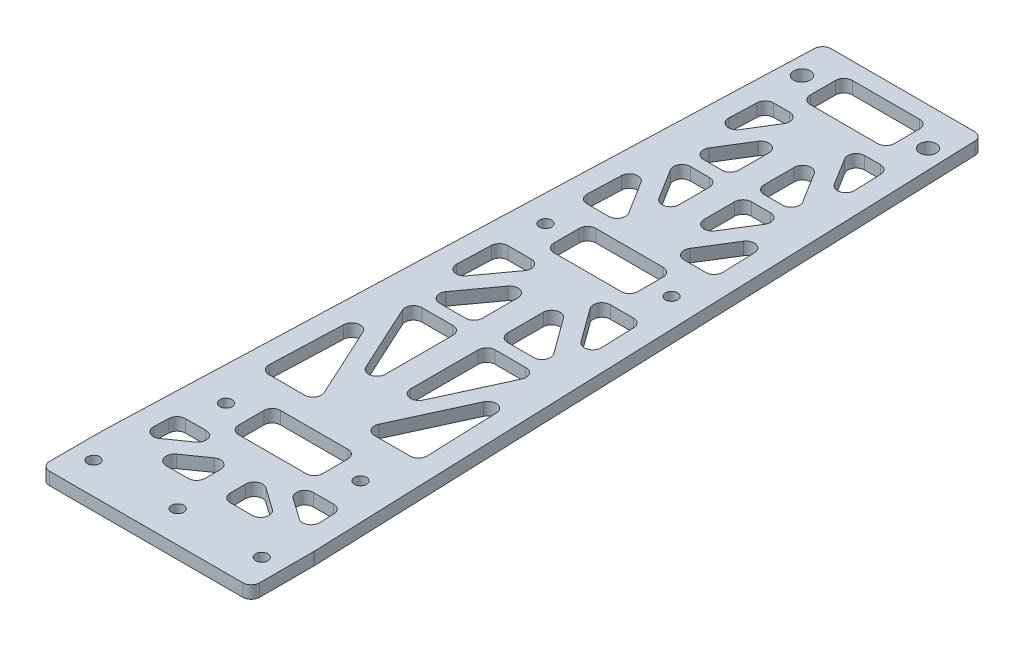
from build123d import *

# Parameters (mm, degrees)
SKETCH_1_R          = 1.45
SKETCH_1_R_2        = 1.95
EXTRUDE_1_DEPTH     = 3
EXTRUDE_2_DEPTH     = 3
FILLET_1_R          = 2
SKETCH_3_R          = 1.45
CUT_EXTRUDE_1_DEPTH = 167.910155473
SKETCH_4_R          = 1.45
CUT_EXTRUDE_2_DEPTH = 167.910155473
CUT_EXTRUDE_3_DEPTH = 167.910155473
SKETCH_6_W          = 6
SKETCH_6_H          = 147
EXTRUDE_3_DEPTH     = 3
EXTRUDE_6_DEPTH     = 3
FILLET_2_R          = 2
SKETCH_7_W          = 20
SKETCH_7_H          = 10
CUT_EXTRUDE_4_DEPTH = 167.910155473
FILLET_3_R          = 2


with BuildPart() as part:
    # 草图1 → 凸台-拉伸1 (new body)
    with BuildSketch(Plane(origin=(0, 0, 0), x_dir=(1, 0, 0), z_dir=(0, 1, 0))):
        Polygon((-25, 0), (-19, 0), (-19, 165), (19, 165), (19, 0), (25, 0), (25, -15), (-25, -15), align=None)
        with Locations(Location((0, -7.5, 0), (0, 0, 270))):
            Circle(SKETCH_1_R, mode=Mode.SUBTRACT)
        with Locations(Location((20, -7.5, 0), (0, 0, 270))):
            Circle(SKETCH_1_R, mode=Mode.SUBTRACT)
        with Locations(Location((-20, -7.5, 0), (0, 0, 270))):
            Circle(SKETCH_1_R, mode=Mode.SUBTRACT)
        with Locations(Location((-15, 156, 0), (0, 0, 270))):
            Circle(SKETCH_1_R_2, mode=Mode.SUBTRACT)
        with Locations(Location((15, 156, 0), (0, 0, 270))):
            Circle(SKETCH_1_R_2, mode=Mode.SUBTRACT)
    extrude(amount=EXTRUDE_1_DEPTH)

    # 草图2 → 凸台-拉伸2 (add)
    with BuildSketch(Plane(origin=(0, 3, 0), x_dir=(1, 0, 0), z_dir=(0, 1, 0))):
        Polygon((-19, 165), (-25, 0), (-19, 0), align=None)
        Polygon((19, 165), (25, 0), (19, 0), align=None)
    extrude(amount=-EXTRUDE_2_DEPTH)

    # 圆角1
    fillet_1_edges = [part.edges().sort_by_distance(p)[0] for p in [
        (-19, 1.5, -165),
        (19, 1.5, -165),
        (25, 1.5, 0),
        (25, 1.5, 15),
        (-25, 1.5, 15),
        (-25, 1.5, 0),
    ]]
    fillet(fillet_1_edges, radius=FILLET_1_R)

    # 草图3 → 切除-拉伸1 (cut, through all)
    with BuildSketch(Plane(origin=(0, 3, 0), x_dir=(1, 0, 0), z_dir=(0, 1, 0))):
        with Locations(Location((16, 20, 0), (0, 0, 270))):
            Circle(SKETCH_3_R)
        with Locations(Location((-16, 20, 0), (0, 0, 270))):
            Circle(SKETCH_3_R)
    extrude(amount=-CUT_EXTRUDE_1_DEPTH, mode=Mode.SUBTRACT)

    # 草图4 → 切除-拉伸2 (cut, through all)
    with BuildSketch(Plane(origin=(0, 3, 0), x_dir=(1, 0, 0), z_dir=(0, 1, 0))):
        with Locations(Location((-15, 95, 0), (0, 0, 270))):
            Circle(SKETCH_4_R)
        with Locations(Location((15, 95, 0), (0, 0, 270))):
            Circle(SKETCH_4_R)
    extrude(amount=-CUT_EXTRUDE_2_DEPTH, mode=Mode.SUBTRACT)

    # 草图5 → 切除-拉伸3 (cut, through all)
    with BuildSketch(Plane(origin=(0, 3, 0), x_dir=(1, 0, 0), z_dir=(0, 1, 0))):
        Polygon((-15.378513489, 127), (0, 127), (0, 147), (-14.651240762, 147), align=None)
        Polygon((0, 147), (0, 127), (15.378513489, 127), (14.651240762, 147), align=None)
        Polygon((-16.214877125, 104), (0, 104), (0, 124), (-15.487604398, 124), align=None)
        Polygon((0, 124), (0, 104), (16.214877125, 104), (15.487604398, 124), align=None)
        Polygon((-17.596695307, 66), (0, 66), (0, 86), (-16.86942258, 86), align=None)
        Polygon((0, 86), (0, 66), (17.596695307, 66), (16.86942258, 86), align=None)
        Polygon((-18.86942258, 31), (0, 31), (0, 63), (-17.705786216, 63), align=None)
        Polygon((0, 63), (0, 31), (18.86942258, 31), (17.705786216, 63), align=None)
        Polygon((-19.996695307, 0), (0, 0), (0, 12), (-19.560331671, 12), align=None)
        Polygon((0, 12), (0, 0), (19.996695307, 0), (19.560331671, 12), align=None)
    extrude(amount=-CUT_EXTRUDE_3_DEPTH, mode=Mode.SUBTRACT)

    # 草图6 → 凸台-拉伸3 (add)
    with BuildSketch(Plane(origin=(0, 3, 0), x_dir=(1, 0, 0), z_dir=(0, 1, 0))):
        with Locations((0, 73.5)):
            Rectangle(SKETCH_6_W, SKETCH_6_H)
    extrude(amount=-EXTRUDE_3_DEPTH)

    # 草图9 → 凸台-拉伸6 (add)
    with BuildSketch(Plane(origin=(0, 3, 0), x_dir=(1, 0, 0), z_dir=(0, 1, 0))):
        Polygon((-15.378513489, 127), (-3, 147), (-5.352079072, 147), (-15.231696253, 131.037473983), align=None)
        Polygon((-3, 143.199739049), (-3, 147), (-15.378513489, 127), (-13.026434417, 127), align=None)
        Polygon((15.378513489, 127), (3, 147), (3, 143.199739049), (13.026434417, 127), align=None)
        Polygon((5.352079072, 147), (3, 147), (15.378513489, 127), (15.231696253, 131.037473983), align=None)
        Polygon((-3, 104), (-15.487604398, 124), (-15.617366609, 120.431539197), (-5.357838552, 104), align=None)
        Polygon((-13.129765846, 124), (-15.487604398, 124), (-3, 104), (-3, 107.77628643), align=None)
        Polygon((15.617366609, 120.431539197), (15.487604398, 124), (3, 104), (5.357838552, 104), align=None)
        Polygon((3, 104), (15.487604398, 124), (13.129765846, 124), (3, 107.77628643), align=None)
        Polygon((-3, 82.607434915), (-3, 86), (-17.596695307, 66), (-15.120683365, 66), align=None)
        Polygon((-17.596695307, 66), (-3, 86), (-5.476011942, 86), (-17.466860345, 69.570461464), align=None)
        Polygon((17.596695307, 66), (3, 86), (3, 82.607434915), (15.120683365, 66), align=None)
        Polygon((5.476011942, 86), (3, 86), (17.596695307, 66), (17.466860345, 69.570461464), align=None)
        Polygon((-15.504703254, 63), (-17.705786216, 63), (-3, 31), (-3, 35.789587836), align=None)
        Polygon((-3, 31), (-17.705786216, 63), (-17.867182143, 58.561611998), (-5.201082962, 31), align=None)
        Polygon((3, 31), (17.705786216, 63), (15.504703254, 63), (3, 35.789587836), align=None)
        Polygon((17.867182143, 58.561611998), (17.705786216, 63), (3, 31), (5.201082962, 31), align=None)
        Polygon((-19.996695307, 0), (-3, 12), (-6.467658718, 12), (-19.905322731, 2.512745846), align=None)
        Polygon((-3, 9.551764984), (-3, 12), (-19.996695307, 0), (-16.529036589, 0), align=None)
        Polygon((6.467658718, 12), (3, 12), (19.996695307, 0), (19.905322731, 2.512745846), align=None)
        Polygon((19.996695307, 0), (3, 12), (3, 9.551764984), (16.529036589, 0), align=None)
    extrude(amount=-EXTRUDE_6_DEPTH)

    # 圆角2
    fillet_2_edges = [part.edges().sort_by_distance(p)[0] for p in [
        (-14.651240762, 1.5, -147),
        (14.651240762, 1.5, -147),
        (16.214877125, 1.5, -104),
        (-16.214877125, 1.5, -104),
        (-16.86942258, 1.5, -86),
        (16.86942258, 1.5, -86),
        (18.86942258, 1.5, -31),
        (-18.86942258, 1.5, -31),
        (-19.560331671, 1.5, -12),
        (19.560331671, 1.5, -12),
        (-3, 1.5, -63),
        (-3, 1.5, -66),
        (-3, 1.5, -124),
        (-3, 1.5, -127),
        (3, 1.5, -63),
        (3, 1.5, -66),
        (3, 1.5, -124),
        (3, 1.5, -127),
        (3, 1.5, 0),
        (-3, 1.5, 0),
        (15.120683365, 1.5, -66),
        (3, 1.5, -82.607434915),
        (5.476011942, 1.5, -86),
        (17.466860345, 1.5, -69.570461464),
        (-15.504703254, 1.5, -63),
        (-3, 1.5, -35.789587836),
        (-5.201082962, 1.5, -31),
        (-17.867182143, 1.5, -58.561611998),
        (3, 1.5, -35.789587836),
        (15.504703254, 1.5, -63),
        (17.867182143, 1.5, -58.561611998),
        (5.201082962, 1.5, -31),
        (-19.905322731, 1.5, -2.512745846),
        (-6.467658718, 1.5, -12),
        (-3, 1.5, -9.551764984),
        (-16.529036589, 1.5, 0),
        (13.026434417, 1.5, -127),
        (3, 1.5, -143.199739049),
        (5.352079072, 1.5, -147),
        (15.231696253, 1.5, -131.037473983),
        (-5.357838552, 1.5, -104),
        (-15.617366609, 1.5, -120.431539197),
        (-13.129765846, 1.5, -124),
        (-3, 1.5, -107.77628643),
        (15.617366609, 1.5, -120.431539197),
        (5.357838552, 1.5, -104),
        (3, 1.5, -107.77628643),
        (13.129765846, 1.5, -124),
        (-3, 1.5, -82.607434915),
        (-15.120683365, 1.5, -66),
        (-17.466860345, 1.5, -69.570461464),
        (-5.476011942, 1.5, -86),
        (6.467658718, 1.5, -12),
        (19.905322731, 1.5, -2.512745846),
        (16.529036589, 1.5, 0),
        (3, 1.5, -9.551764984),
        (-15.231696253, 1.5, -131.037473983),
        (-5.352079072, 1.5, -147),
        (-3, 1.5, -143.199739049),
        (-13.026434417, 1.5, -127),
    ]]
    fillet(fillet_2_edges, radius=FILLET_2_R)

    # 草图7 → 切除-拉伸4 (cut, through all)
    with BuildSketch(Plane(origin=(0, 3, 0), x_dir=(1, 0, 0), z_dir=(0, 1, 0))):
        with Locations((0, 156)):
            Rectangle(SKETCH_7_W, SKETCH_7_H)
        with Locations((0, 95)):
            Rectangle(SKETCH_7_W, SKETCH_7_H)
        with Locations((0, 20)):
            Rectangle(SKETCH_7_W, SKETCH_7_H)
    extrude(amount=-CUT_EXTRUDE_4_DEPTH, mode=Mode.SUBTRACT)

    # 圆角3
    fillet_3_edges = [part.edges().sort_by_distance(p)[0] for p in [
        (10, 1.5, -161),
        (10, 1.5, -151),
        (-10, 1.5, -151),
        (-10, 1.5, -161),
        (10, 1.5, -100),
        (10, 1.5, -90),
        (-10, 1.5, -90),
        (-10, 1.5, -100),
        (10, 1.5, -25),
        (10, 1.5, -15),
        (-10, 1.5, -15),
        (-10, 1.5, -25),
    ]]
    fillet(fillet_3_edges, radius=FILLET_3_R)


solid = part.part
